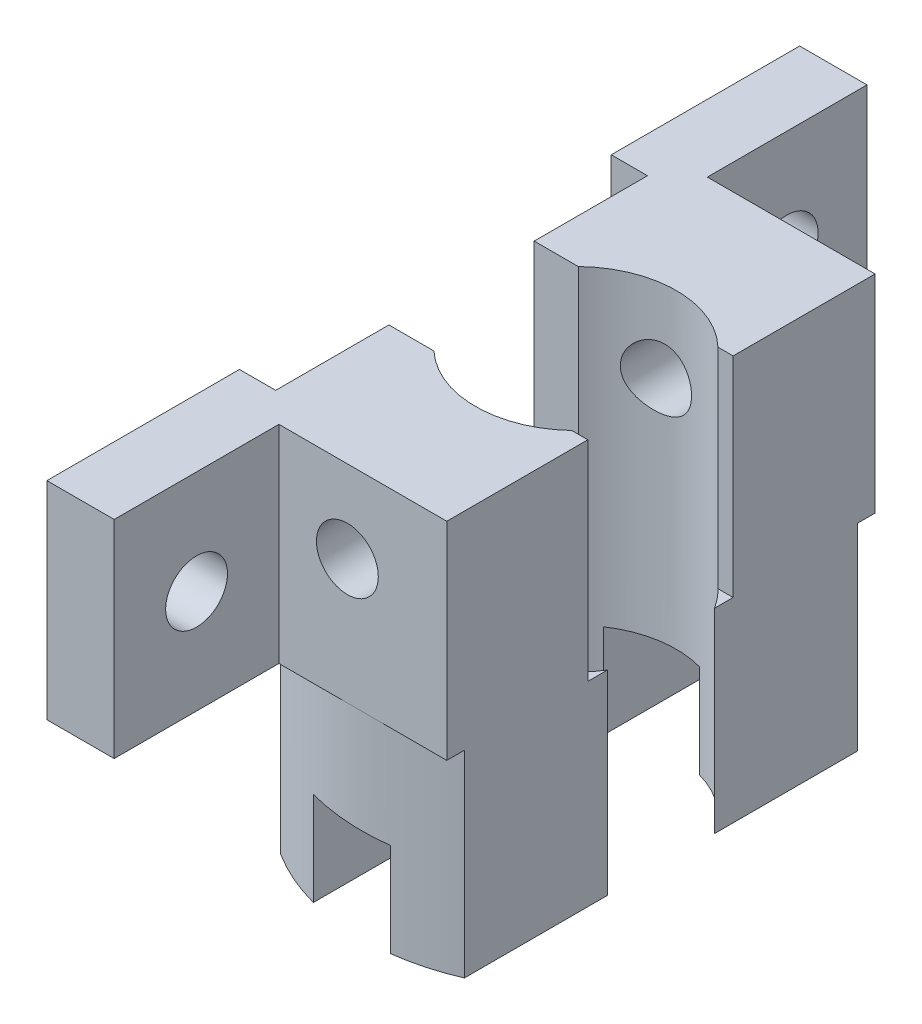
from build123d import *

# Parameters (mm, degrees)
SKETCH_1_R           = 20.68
SKETCH_1_R_2         = 9.68
EXTRUDE_1_DEPTH      = 116.68
SKETCH_11_W          = 27
SKETCH_11_H          = 150
CUT_EXTRUDE_3_DEPTH  = 40
SKETCH_13_W          = 10
SKETCH_13_H          = 128.345013401
CUT_EXTRUDE_7_DEPTH  = 126.614916312
SKETCH_15_W          = 8
SKETCH_15_H          = 68.68
CUT_EXTRUDE_9_DEPTH  = 48
SKETCH_16_W          = 15.549431524
SKETCH_16_H          = 20
SKETCH_16_W_2        = 15.459431524
EXTRUDE_4_DEPTH      = 19.2
SKETCH_17_W          = 19.20851187
SKETCH_17_H          = 14.03
CUT_EXTRUDE_10_DEPTH = 20.2
SKETCH_18_R          = 9.59
CUT_EXTRUDE_11_DEPTH = 121.289430957
SKETCH_21_R          = 2.985
CUT_EXTRUDE_12_DEPTH = 55.2
EXTRUDE_START        = 55.2
SKETCH_24_R          = 20.59
SKETCH_24_R_2        = 9.59
EXTRUDE_2_DEPTH      = 55.2
CUT_EXTRUDE_13_DEPTH = 55.2
SKETCH_26_W          = 10.00851187
SKETCH_26_H          = 41.68
CUT_EXTRUDE_15_DEPTH = 55.2
SKETCH_27_W          = 10
SKETCH_27_H          = 40
CUT_EXTRUDE_16_DEPTH = 55.2
SKETCH_28_W          = 44.880694938
SKETCH_28_H          = 9.608044066
CUT_EXTRUDE_17_DEPTH = 12.2
SKETCH_35_W          = 13.53
SKETCH_35_H          = 20
EXTRUDE_10_DEPTH     = 15
EXTRUDE_11_DEPTH     = 15
SKETCH_37_W          = 9
SKETCH_37_H          = 20
EXTRUDE_12_DEPTH     = 20
SKETCH_38_W          = 9
SKETCH_38_H          = 20
EXTRUDE_13_DEPTH     = 20
SKETCH_42_R          = 2.985
CUT_EXTRUDE_21_DEPTH = 20
CUT_EXTRUDE_23_DEPTH = 138.235841092
SKETCH_45_W          = 3
SKETCH_45_H          = 20
EXTRUDE_14_DEPTH     = 30
SKETCH_46_W          = 3
SKETCH_46_H          = 20
EXTRUDE_15_DEPTH     = 30
SKETCH_47_W          = 33.078221107
SKETCH_47_H          = 20
EXTRUDE_16_DEPTH     = 50
SKETCH_48_W          = 30
SKETCH_48_H          = 20
EXTRUDE_17_DEPTH     = 50
SKETCH_50_W          = 50
SKETCH_50_H          = 20
EXTRUDE_18_DEPTH     = 1
SKETCH_51_W          = 50
SKETCH_51_H          = 20
EXTRUDE_19_DEPTH     = 1
SKETCH_52_W          = 53
SKETCH_52_H          = 14
CUT_EXTRUDE_24_DEPTH = 151.972575738
SKETCH_53_W          = 53
SKETCH_53_H          = 14
CUT_EXTRUDE_25_DEPTH = 151.942387436
SKETCH_54_W          = 40
SKETCH_54_H          = 73.27
CUT_EXTRUDE_26_DEPTH = 147.866192927
SKETCH_56_W          = 13.00851187
SKETCH_56_H          = 20
EXTRUDE_21_DEPTH     = 3.08
SKETCH_58_W          = 44.672014854
SKETCH_58_H          = 95.939897673
CUT_EXTRUDE_28_DEPTH = 149.701311438
SKETCH_59_R          = 9.7
CUT_EXTRUDE_29_DEPTH = 60.553551814
SKETCH_60_W          = 6.504255935
SKETCH_60_H          = 76.35
CUT_EXTRUDE_30_DEPTH = 60.553551814
CUT_EXTRUDE_32_DEPTH = 20
SKETCH_64_W          = 16.20851187
SKETCH_64_H          = 0.09
EXTRUDE_22_DEPTH     = 20
SKETCH_65_W          = 3.495744065
SKETCH_65_H          = 3.26
CUT_EXTRUDE_33_DEPTH = 58.582567932
SKETCH_66_W          = 3.495744065
SKETCH_66_H          = 1.776778893
SKETCH_66_W_2        = 3.503635083
SKETCH_66_H_2        = 1.775
EXTRUDE_23_DEPTH     = 20.2
SKETCH_68_W          = 6.504255935
SKETCH_68_H          = 3.66
CUT_EXTRUDE_34_DEPTH = 20
SKETCH_69_R          = 2.985
CUT_EXTRUDE_35_DEPTH = 124.351086443
SKETCH_70_R          = 2.985
CUT_EXTRUDE_36_DEPTH = 131.530092773


with BuildPart() as part:
    # 草圖1 → 伸長-薄件1 (new body)
    with BuildSketch(Plane(origin=(0, 0, 0), x_dir=(1, 0, 0), z_dir=(0, 1, 0))):
        Circle(SKETCH_1_R)
        Circle(SKETCH_1_R_2, mode=Mode.SUBTRACT)
    extrude(amount=EXTRUDE_1_DEPTH)

    # 草圖11 → 除料-伸長3 (cut)
    with BuildSketch(Plane(origin=(0, 116.68, 0), x_dir=(1, 0, 0), z_dir=(0, 1, 0))):
        with Locations((21.70851187, -44.235815192)):
            Rectangle(SKETCH_11_W, SKETCH_11_H)
    extrude(amount=-CUT_EXTRUDE_3_DEPTH, mode=Mode.SUBTRACT)

    # 草圖13 → 除料-伸長7 (cut, through all)
    with BuildSketch(Plane.XY.offset(21)):
        with Locations((-16, 58.612182466)):
            Rectangle(SKETCH_13_W, SKETCH_13_H)
    extrude(amount=-CUT_EXTRUDE_7_DEPTH, mode=Mode.SUBTRACT)

    # 草圖15 → 除料-伸長9 (cut)
    with BuildSketch(Plane.XY.offset(21)):
        with Locations((-1.395744065, 52.34)):
            Rectangle(SKETCH_15_W, SKETCH_15_H)
    extrude(amount=-CUT_EXTRUDE_9_DEPTH, mode=Mode.SUBTRACT)

    # 草圖16 → 填料-伸長4 (add)
    with BuildSketch(Plane(origin=(8.20851187, 0, 0), x_dir=(0, 0, -1), z_dir=(1, 0, 0))):
        with Locations((12.905284238, 106.68)):
            Rectangle(SKETCH_16_W, SKETCH_16_H)
        with Locations((-12.860284238, 106.68)):
            Rectangle(SKETCH_16_W_2, SKETCH_16_H)
    extrude(amount=-EXTRUDE_4_DEPTH)

    # 草圖17 → 除料-伸長10 (cut)
    with BuildSketch(Plane(origin=(0, 116.68, 0), x_dir=(1, 0, 0), z_dir=(0, 1, 0))):
        with Locations((-1.395744065, -0.045)):
            Rectangle(SKETCH_17_W, SKETCH_17_H)
    extrude(amount=-CUT_EXTRUDE_10_DEPTH, mode=Mode.SUBTRACT)

    # 草圖18 → 除料-伸長11 (cut, through all)
    with BuildSketch(Plane.XZ):
        with Locations(Location((0, 0, 0), (0, 0, 90))):
            Circle(SKETCH_18_R)
    extrude(amount=-CUT_EXTRUDE_11_DEPTH, mode=Mode.SUBTRACT)

    # 草圖21 → 除料-伸長12 (cut)
    with BuildSketch(Plane(origin=(0, 0, -20.68), x_dir=(-1, 0, 0), z_dir=(0, 0, -1))):
        with Locations((1.39148813, 108.73)):
            Circle(SKETCH_21_R)
    extrude(amount=-CUT_EXTRUDE_12_DEPTH, mode=Mode.SUBTRACT)

    # 草圖24 → 伸長-薄件2 (add)
    with BuildSketch(Plane.XZ.offset(EXTRUDE_START)):
        Circle(SKETCH_24_R)
        Circle(SKETCH_24_R_2, mode=Mode.SUBTRACT)
    extrude(amount=-EXTRUDE_2_DEPTH)

    # 草圖25 → 除料-伸長13 (cut)
    with BuildSketch(Plane.XY.offset(21)):
        Polygon((-1.39148813, -11.785), (22.612379708, -11.785), (22.612379708, -63.873337429), (-22.749525245, -63.873337429), (-22.749525245, -11.785), align=None)
    extrude(amount=-CUT_EXTRUDE_13_DEPTH, mode=Mode.SUBTRACT)

    # 草圖26 → 除料-伸長15 (cut)
    with BuildSketch(Plane(origin=(0, 0, 0), x_dir=(1, 0, 0), z_dir=(0, 1, 0))):
        with Locations((-15.995744065, -0.16)):
            Rectangle(SKETCH_26_W, SKETCH_26_H)
    extrude(amount=-CUT_EXTRUDE_15_DEPTH, mode=Mode.SUBTRACT)

    # 草圖27 → 除料-伸長16 (cut)
    with BuildSketch(Plane(origin=(21, 0, 0), x_dir=(0, 0, -1), z_dir=(1, 0, 0))):
        with Locations((0, 41.68)):
            Rectangle(SKETCH_27_W, SKETCH_27_H)
    extrude(amount=-CUT_EXTRUDE_16_DEPTH, mode=Mode.SUBTRACT)

    # 草圖28 → 除料-伸長17 (cut)
    with BuildSketch(Plane(origin=(21, 0, 0), x_dir=(0, 0, -1), z_dir=(1, 0, 0))):
        Rectangle(SKETCH_28_W, SKETCH_28_H)
    extrude(amount=-CUT_EXTRUDE_17_DEPTH, mode=Mode.SUBTRACT)

    # 草圖35 → 填料-伸長10 (add)
    with BuildSketch(Plane.ZY.offset(10.99148813)):
        with Locations((13.825, 106.68)):
            Rectangle(SKETCH_35_W, SKETCH_35_H)
    extrude(amount=EXTRUDE_10_DEPTH)

    # 草圖36 → 填料-伸長11 (add)
    with BuildSketch(Plane.ZY.offset(10.99148813)):
        Polygon((-20.68, 116.68), (-6.97, 116.68), (-6.97, 96.48), (-20.68, 96.68), align=None)
    extrude(amount=EXTRUDE_11_DEPTH)

    # 草圖37 → 填料-伸長12 (add)
    with BuildSketch(Plane.XY.offset(20.59)):
        with Locations((-21.49148813, 106.68)):
            Rectangle(SKETCH_37_W, SKETCH_37_H)
    extrude(amount=EXTRUDE_12_DEPTH)

    # 草圖38 → 填料-伸長13 (add)
    with BuildSketch(Plane(origin=(0, 0, -20.68), x_dir=(-1, 0, 0), z_dir=(0, 0, -1))):
        with Locations((21.49148813, 106.68)):
            Rectangle(SKETCH_38_W, SKETCH_38_H)
    extrude(amount=EXTRUDE_13_DEPTH)

    # 草圖42 → 除料-伸長21 (cut)
    with BuildSketch(Plane(origin=(-16.99148813, 0, 0), x_dir=(0, 0, -1), z_dir=(1, 0, 0))):
        with Locations((30.68, 106.554418142)):
            Circle(SKETCH_42_R)
        with Locations((-30.395640125, 106.68)):
            Circle(SKETCH_42_R)
    extrude(amount=-CUT_EXTRUDE_21_DEPTH, mode=Mode.SUBTRACT)

    # 草圖43 → 除料-伸長23 (cut, through all)
    with BuildSketch(Plane(origin=(0, 116.68, 0), x_dir=(1, 0, 0), z_dir=(0, 1, 0))):
        Polygon((-11, 6.97), (-10.99148813, 20.68), (-10.99148813, 48.096794253), (-28.274756234, 48.096794253), (-28.274756234, -43.270506289), (-11, -43.270506289), align=None)
    extrude(amount=-CUT_EXTRUDE_23_DEPTH, mode=Mode.SUBTRACT)

    # 草圖45 → 填料-伸長14 (add)
    with BuildSketch(Plane.XY.offset(20.59)):
        with Locations((-9.5, 106.68)):
            Rectangle(SKETCH_45_W, SKETCH_45_H)
    extrude(amount=EXTRUDE_14_DEPTH)

    # 草圖46 → 填料-伸長15 (add)
    with BuildSketch(Plane(origin=(0, 0, -20.68), x_dir=(-1, 0, 0), z_dir=(0, 0, -1))):
        with Locations((9.49148813, 106.68)):
            Rectangle(SKETCH_46_W, SKETCH_46_H)
    extrude(amount=EXTRUDE_15_DEPTH)

    # 草圖47 → 填料-伸長16 (add)
    with BuildSketch(Plane.ZY.offset(11)):
        with Locations((34.050889447, 106.68)):
            Rectangle(SKETCH_47_W, SKETCH_47_H)
    extrude(amount=EXTRUDE_16_DEPTH)

    # 草圖48 → 填料-伸長17 (add)
    with BuildSketch(Plane.ZY.offset(10.99148813)):
        with Locations((-35.68, 106.68)):
            Rectangle(SKETCH_48_W, SKETCH_48_H)
    extrude(amount=EXTRUDE_17_DEPTH)

    # 草圖50 → 填料-伸長18 (add)
    with BuildSketch(Plane(origin=(0, 0, 17.511778893), x_dir=(-1, 0, 0), z_dir=(0, 0, -1))):
        with Locations((36, 106.68)):
            Rectangle(SKETCH_50_W, SKETCH_50_H)
    extrude(amount=EXTRUDE_18_DEPTH)

    # 草圖51 → 填料-伸長19 (add)
    with BuildSketch(Plane.XY.offset(-20.68)):
        with Locations((-35.99148813, 106.68)):
            Rectangle(SKETCH_51_W, SKETCH_51_H)
    extrude(amount=EXTRUDE_19_DEPTH)

    # 草圖52 → 除料-伸長24 (cut, through all)
    with BuildSketch(Plane(origin=(0, 116.68, 0), x_dir=(1, 0, 0), z_dir=(0, 1, 0))):
        with Locations((-34.49148813, 43.68)):
            Rectangle(SKETCH_52_W, SKETCH_52_H)
    extrude(amount=-CUT_EXTRUDE_24_DEPTH, mode=Mode.SUBTRACT)

    # 草圖53 → 除料-伸長25 (cut, through all)
    with BuildSketch(Plane(origin=(0, 116.68, 0), x_dir=(1, 0, 0), z_dir=(0, 1, 0))):
        with Locations((-34.5, -43.59)):
            Rectangle(SKETCH_53_W, SKETCH_53_H)
    extrude(amount=-CUT_EXTRUDE_25_DEPTH, mode=Mode.SUBTRACT)

    # 草圖54 → 除料-伸長26 (cut, through all)
    with BuildSketch(Plane(origin=(0, 116.68, 0), x_dir=(1, 0, 0), z_dir=(0, 1, 0))):
        with Locations((-41, 0.045)):
            Rectangle(SKETCH_54_W, SKETCH_54_H)
    extrude(amount=-CUT_EXTRUDE_26_DEPTH, mode=Mode.SUBTRACT)

    # 草圖56 → 填料-伸長21 (add)
    with BuildSketch(Plane(origin=(0, 0, -36.68), x_dir=(-1, 0, 0), z_dir=(0, 0, -1))):
        with Locations((14.495744065, 106.68)):
            Rectangle(SKETCH_56_W, SKETCH_56_H)
    extrude(amount=EXTRUDE_21_DEPTH)

    # 草圖58 → 除料-伸長28 (cut, through all)
    with BuildSketch(Plane.XY.offset(50)):
        with Locations((-0.234953045, 29.661774302)):
            Rectangle(SKETCH_58_W, SKETCH_58_H)
    extrude(amount=-CUT_EXTRUDE_28_DEPTH, mode=Mode.SUBTRACT)

    # 草圖59 → 除料-伸長29 (cut, through all)
    with BuildSketch(Plane.XZ.offset(-77.631723139)):
        Circle(SKETCH_59_R)
    extrude(amount=-CUT_EXTRUDE_29_DEPTH, mode=Mode.SUBTRACT)

    # 草圖60 → 除料-伸長30 (cut, through all)
    with BuildSketch(Plane(origin=(0, 116.68, 0), x_dir=(1, 0, 0), z_dir=(0, 1, 0))):
        with Locations((-17.747872032, 1.585)):
            Rectangle(SKETCH_60_W, SKETCH_60_H)
    extrude(amount=-CUT_EXTRUDE_30_DEPTH, mode=Mode.SUBTRACT)

    # 草圖61 → 除料-伸長32 (cut)
    with BuildSketch(Plane(origin=(0, 116.68, 0), x_dir=(1, 0, 0), z_dir=(0, 1, 0))):
        Polygon((1.92725193, -20.59), (1.92725193, -22.399121663), (-2.174190472, -21.421542421), (-2.174190472, -20.59), align=None)
    extrude(amount=-CUT_EXTRUDE_32_DEPTH, mode=Mode.SUBTRACT)

    # 草圖64 → 填料-伸長22 (add)
    with BuildSketch(Plane(origin=(0, 116.68, 0), x_dir=(1, 0, 0), z_dir=(0, 1, 0))):
        with Locations((0.104255935, -20.635)):
            Rectangle(SKETCH_64_W, SKETCH_64_H)
    extrude(amount=-EXTRUDE_22_DEPTH)

    # 草圖65 → 除料-伸長33 (cut, through all)
    with BuildSketch(Plane(origin=(0, 116.68, 0), x_dir=(1, 0, 0), z_dir=(0, 1, 0))):
        with Locations((-12.747872033, -18.141778893)):
            Rectangle(SKETCH_65_W, SKETCH_65_H)
    extrude(amount=-CUT_EXTRUDE_33_DEPTH, mode=Mode.SUBTRACT)

    # 草圖66 → 填料-伸長23 (add)
    with BuildSketch(Plane(origin=(0, 96.48, 0), x_dir=(1, 0, 0), z_dir=(0, 1, 0))):
        with Locations((-12.747872033, -18.883389447)):
            Rectangle(SKETCH_66_W, SKETCH_66_H)
        with Locations((-12.743926524, 18.7925)):
            Rectangle(SKETCH_66_W_2, SKETCH_66_H_2)
    extrude(amount=EXTRUDE_23_DEPTH)

    # 草圖68 → 除料-伸長34 (cut)
    with BuildSketch(Plane(origin=(0, 116.68, 0), x_dir=(1, 0, 0), z_dir=(0, 1, 0))):
        with Locations((-11.243616098, 37.93)):
            Rectangle(SKETCH_68_W, SKETCH_68_H)
    extrude(amount=-CUT_EXTRUDE_34_DEPTH, mode=Mode.SUBTRACT)

    # 草圖69 → 除料-伸長35 (cut, through all)
    with BuildSketch(Plane(origin=(-7.99148813, 0, 0), x_dir=(0, 0, -1), z_dir=(1, 0, 0))):
        with Locations((28.39, 106.68)):
            Circle(SKETCH_69_R)
        with Locations((-28.635, 106.68)):
            Circle(SKETCH_69_R)
    extrude(amount=-CUT_EXTRUDE_35_DEPTH, mode=Mode.SUBTRACT)

    # 草圖70 → 除料-伸長36 (cut, through all)
    with BuildSketch(Plane(origin=(0, 0, 20.59), x_dir=(-1, 0, 0), z_dir=(0, 0, -1))):
        with Locations((1.39148813, 108.73)):
            Circle(SKETCH_70_R)
    extrude(amount=-CUT_EXTRUDE_36_DEPTH, mode=Mode.SUBTRACT)


solid = part.part
